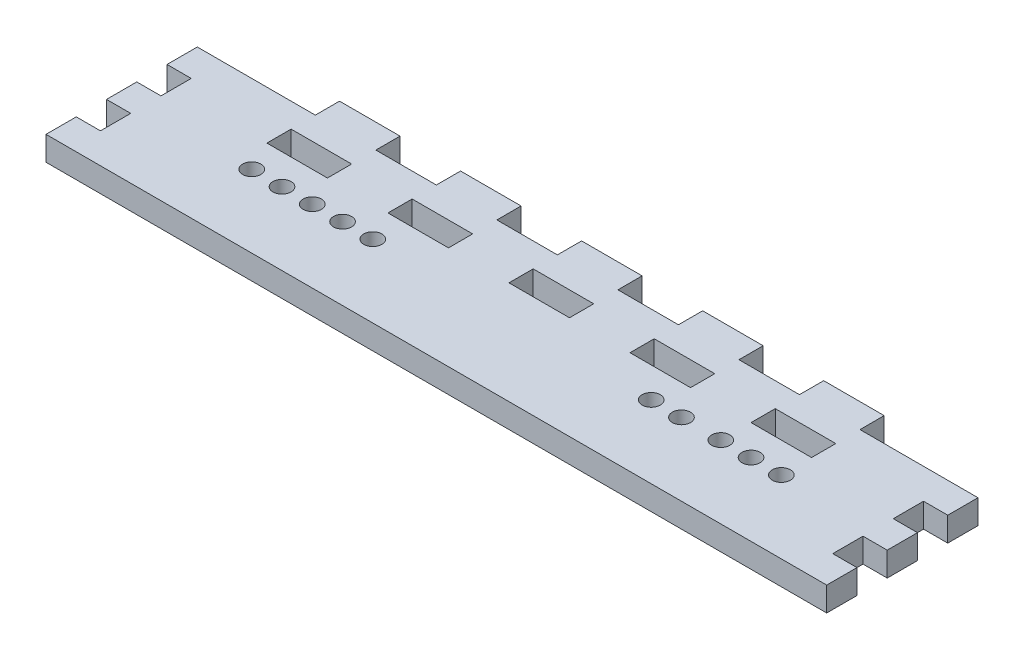
from build123d import *

# Parameters (mm, degrees)
SKETCH1_W           = 121
SKETCH1_H           = 25
BOSS_EXTRUDE1_DEPTH = 4
SKETCH2_W           = 4
SKETCH2_H           = 5
BOSS_EXTRUDE2_DEPTH = 4
LPATTERN1_COUNT     = 3
LPATTERN1_PITCH     = 10
SKETCH3_W           = 10
SKETCH3_H           = 4
BOSS_EXTRUDE3_DEPTH = 4
LPATTERN2_COUNT     = 3
LPATTERN2_PITCH     = 20
LPATTERN2_COL_COUNT = 3
LPATTERN2_COL_PITCH = 20
SKETCH4_W           = 10
SKETCH4_H           = 4
CUT_EXTRUDE1_DEPTH  = 128.538229563
SKETCH6_R           = 1.5
CUT_EXTRUDE3_DEPTH  = 128.538229563


with BuildPart() as part:
    # Sketch1 → Boss-Extrude1 (new body)
    with BuildSketch(Plane(origin=(0, 0, 0), x_dir=(1, 0, 0), z_dir=(0, 1, 0))):
        with Locations((60.5, -12.5)):
            Rectangle(SKETCH1_W, SKETCH1_H)
    extrude(amount=BOSS_EXTRUDE1_DEPTH)

    # Sketch2 → Boss-Extrude2 (add, through all)
    with BuildSketch(Plane(origin=(0, 0, 0), x_dir=(-1, 0, 0), z_dir=(0, -1, 0))):
        with Locations((2, -22.5)):
            Rectangle(SKETCH2_W, SKETCH2_H)
        with Locations((-123, -22.5)):
            Rectangle(SKETCH2_W, SKETCH2_H)
    boss_extrude2 = extrude(amount=-BOSS_EXTRUDE2_DEPTH)

    # LPattern1: Boss-Extrude2 ×3
    with Locations(*[(0, 0, -i * LPATTERN1_PITCH) for i in range(1, LPATTERN1_COUNT)]):
        add(boss_extrude2)

    # Sketch3 → Boss-Extrude3 (add, through all)
    with BuildSketch(Plane(origin=(0, 0, 0), x_dir=(-1, 0, 0), z_dir=(0, -1, 0))):
        with Locations((-60.5, 2)):
            Rectangle(SKETCH3_W, SKETCH3_H)
    boss_extrude3 = extrude(amount=-BOSS_EXTRUDE3_DEPTH)

    # LPattern2: Boss-Extrude3 ×3
    with Locations(*[(i * LPATTERN2_PITCH, 0, 0) for i in range(1, LPATTERN2_COUNT)]):
        add(boss_extrude3)

    # LPattern2 col: Boss-Extrude3 ×3
    with Locations(*[(-i * LPATTERN2_COL_PITCH, 0, 0) for i in range(1, LPATTERN2_COL_COUNT)]):
        add(boss_extrude3)

    # Sketch4 → Cut-Extrude1 (cut, through all)
    with BuildSketch(Plane.XZ):
        with Locations((20.5, 6)):
            Rectangle(SKETCH4_W, SKETCH4_H)
        with Locations((40.5, 6)):
            Rectangle(SKETCH4_W, SKETCH4_H)
        with Locations((60.5, 6)):
            Rectangle(SKETCH4_W, SKETCH4_H)
        with Locations((80.5, 6)):
            Rectangle(SKETCH4_W, SKETCH4_H)
        with Locations((100.5, 6)):
            Rectangle(SKETCH4_W, SKETCH4_H)
    extrude(amount=-CUT_EXTRUDE1_DEPTH, mode=Mode.SUBTRACT)

    # Sketch6 → Cut-Extrude3 (cut, through all)
    with BuildSketch(Plane.XZ):
        with Locations(Location((38, 13, 0), (0, 0, 270))):
            Circle(SKETCH6_R)
        with Locations(Location((33, 13, 0), (0, 0, 270))):
            Circle(SKETCH6_R)
        with Locations(Location((28, 13, 0), (0, 0, 270))):
            Circle(SKETCH6_R)
        with Locations(Location((23, 13, 0), (0, 0, 270))):
            Circle(SKETCH6_R)
        with Locations(Location((18, 13, 0), (0, 0, 270))):
            Circle(SKETCH6_R)
        with Locations(Location((84, 13, 0), (0, 0, 270))):
            Circle(SKETCH6_R)
        with Locations(Location((89, 13, 0), (0, 0, 270))):
            Circle(SKETCH6_R)
        with Locations(Location((95.5, 13, 0), (0, 0, 270))):
            Circle(SKETCH6_R)
        with Locations(Location((100.5, 13, 0), (0, 0, 270))):
            Circle(SKETCH6_R)
        with Locations(Location((105.5, 13, 0), (0, 0, 270))):
            Circle(SKETCH6_R)
    extrude(amount=-CUT_EXTRUDE3_DEPTH, mode=Mode.SUBTRACT)


solid = part.part
